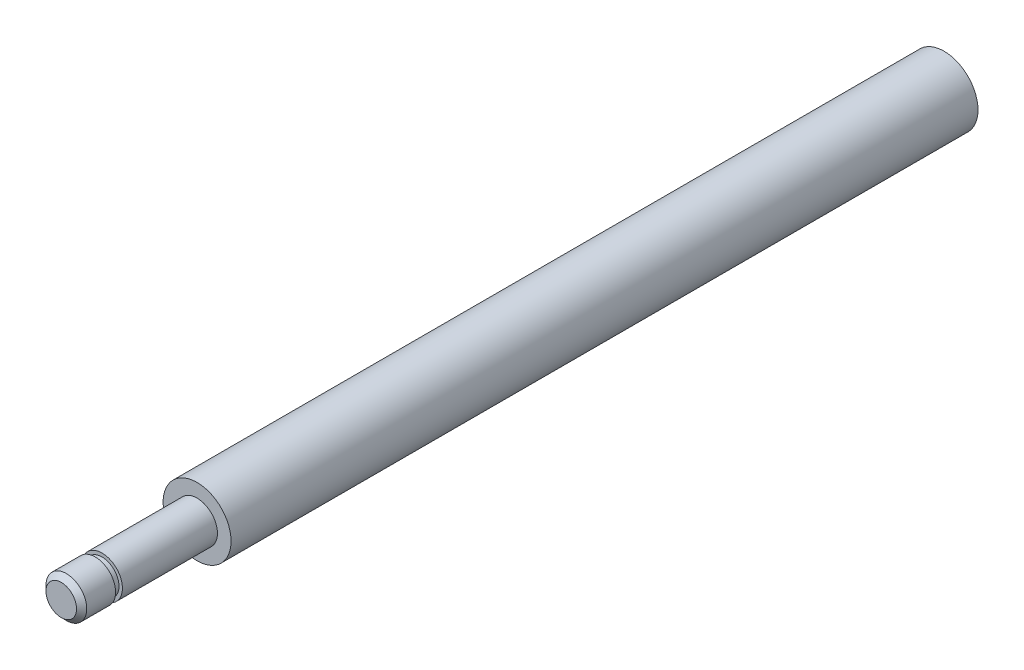
from build123d import *

# Parameters (mm, degrees)
SKETCH_1_R          = 10
EXTRUDE_1_DEPTH     = 260
SKETCH_2_OUTSIDE_W  = 74.306
SKETCH_2_OUTSIDE_H  = 74.306
SKETCH_2_OUTSIDE_R  = 6
CUT_EXTRUDE_1_DEPTH = 40
SKETCH_3_OUTSIDE_W  = 74.306
SKETCH_3_OUTSIDE_H  = 74.306
SKETCH_3_OUTSIDE_R  = 5
CUT_EXTRUDE_2_DEPTH = 2
CHAMFER_1_SIZE      = 1.5


with BuildPart() as part:
    # 草图1 → 凸台-拉伸1 (new body)
    with BuildSketch(Plane.XY):
        Circle(SKETCH_1_R)
    extrude(amount=EXTRUDE_1_DEPTH)

    # 草图2 outside → 切除-拉伸1 (cut)
    with BuildSketch(Plane.XY.offset(260)):
        Rectangle(SKETCH_2_OUTSIDE_W, SKETCH_2_OUTSIDE_H)
        Circle(SKETCH_2_OUTSIDE_R, mode=Mode.SUBTRACT)
    extrude(amount=-CUT_EXTRUDE_1_DEPTH, mode=Mode.SUBTRACT)

    # 草图3 outside → 切除-拉伸2 (cut)
    with BuildSketch(Plane.XY.offset(250)):
        Rectangle(SKETCH_3_OUTSIDE_W, SKETCH_3_OUTSIDE_H)
        Circle(SKETCH_3_OUTSIDE_R, mode=Mode.SUBTRACT)
    extrude(amount=-CUT_EXTRUDE_2_DEPTH, mode=Mode.SUBTRACT)

    # 倒角1
    chamfer_1_edges = [part.edges().sort_by_distance(p)[0] for p in [
        (-6, 0, 260),
    ]]
    chamfer(chamfer_1_edges, length=CHAMFER_1_SIZE)


solid = part.part
